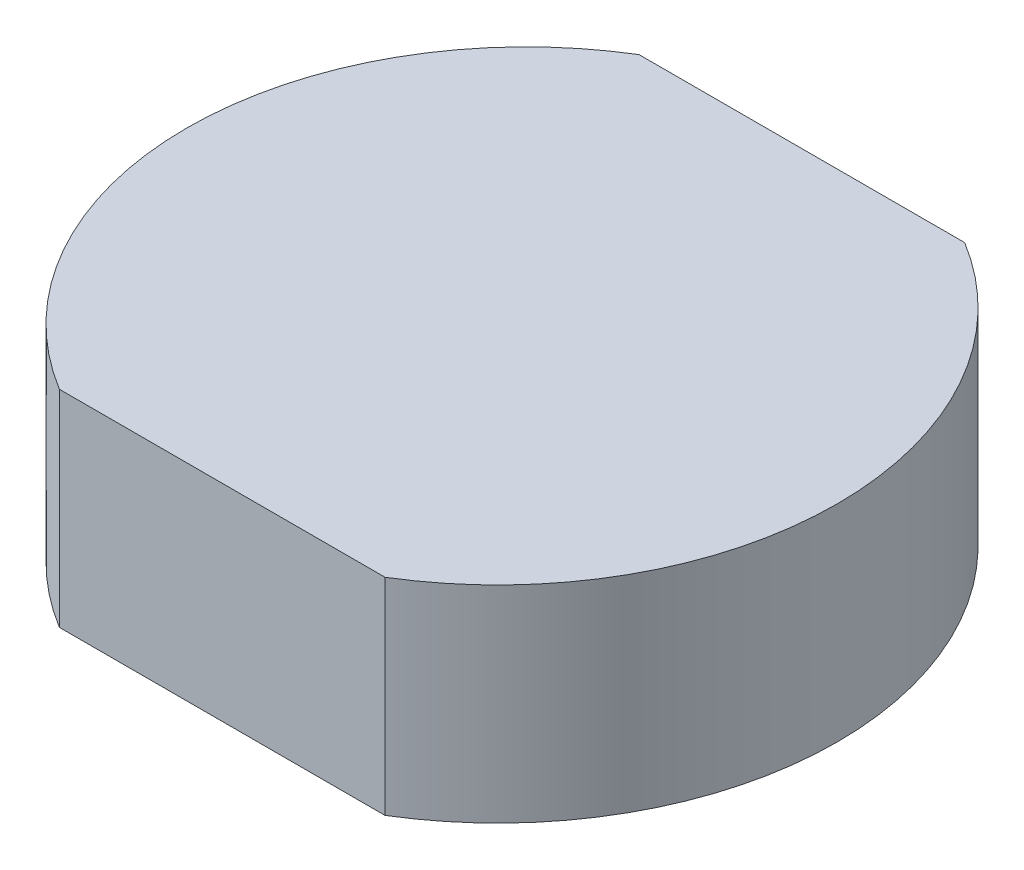
from build123d import *

# Parameters (mm, degrees)
BOSS_EXTRUDE1_DEPTH = 5
BOSS_EXTRUDE2_DEPTH = 0.8
CUT_EXTRUDE1_DEPTH  = 14.556732645


with BuildPart() as part:
    # Sketch1 → Boss-Extrude1 (new body)
    with BuildSketch(Plane(origin=(0, 0, 0), x_dir=(1, 0, 0), z_dir=(0, 1, 0))):
        with BuildLine():
            ThreePointArc((4.577951386, 8.15), (9.15, 0), (4.577951386, -8.15))
            Line((4.577951386, -8.15), (-4.577951386, -8.15))
            ThreePointArc((-4.577951386, -8.15), (-9.15, 0), (-4.577951386, 8.15))
            Line((-4.577951386, 8.15), (4.577951386, 8.15))
        make_face()
        with BuildLine():
            Line((4.347630988, 7.35), (-4.347630988, 7.35))
            ThreePointArc((-4.347630988, 7.35), (-8.35, 0), (-4.347630988, -7.35))
            Line((-4.347630988, -7.35), (4.347630988, -7.35))
            ThreePointArc((4.347630988, -7.35), (8.35, 0), (4.347630988, 7.35))
        make_face(mode=Mode.SUBTRACT)
    extrude(amount=BOSS_EXTRUDE1_DEPTH)

    # Sketch2 → Boss-Extrude2 (add)
    with BuildSketch(Plane(origin=(0, 5, 0), x_dir=(1, 0, 0), z_dir=(0, 1, 0))):
        with BuildLine():
            Line((4.577951386, -8.15), (-4.577951386, -8.15))
            ThreePointArc((-4.577951386, -8.15), (-9.15, 0), (-4.577951386, 8.15))
            Line((-4.577951386, 8.15), (4.577951386, 8.15))
            ThreePointArc((4.577951386, 8.15), (9.15, 0), (4.577951386, -8.15))
        make_face()
    extrude(amount=BOSS_EXTRUDE2_DEPTH)

    # Sketch3 → Cut-Extrude1 (cut, through all)
    with BuildSketch(Plane(origin=(0, 0, 0), x_dir=(0, 0, -1), z_dir=(1, 0, 0))):
        with BuildLine():
            Line((-2, 2), (-2, 0))
            Line((-2, 0), (2, 0))
            Line((2, 0), (2, 2))
            ThreePointArc((2, 2), (0, 4), (-2, 2))
        make_face()
    extrude(amount=-CUT_EXTRUDE1_DEPTH, mode=Mode.SUBTRACT)


solid = part.part
